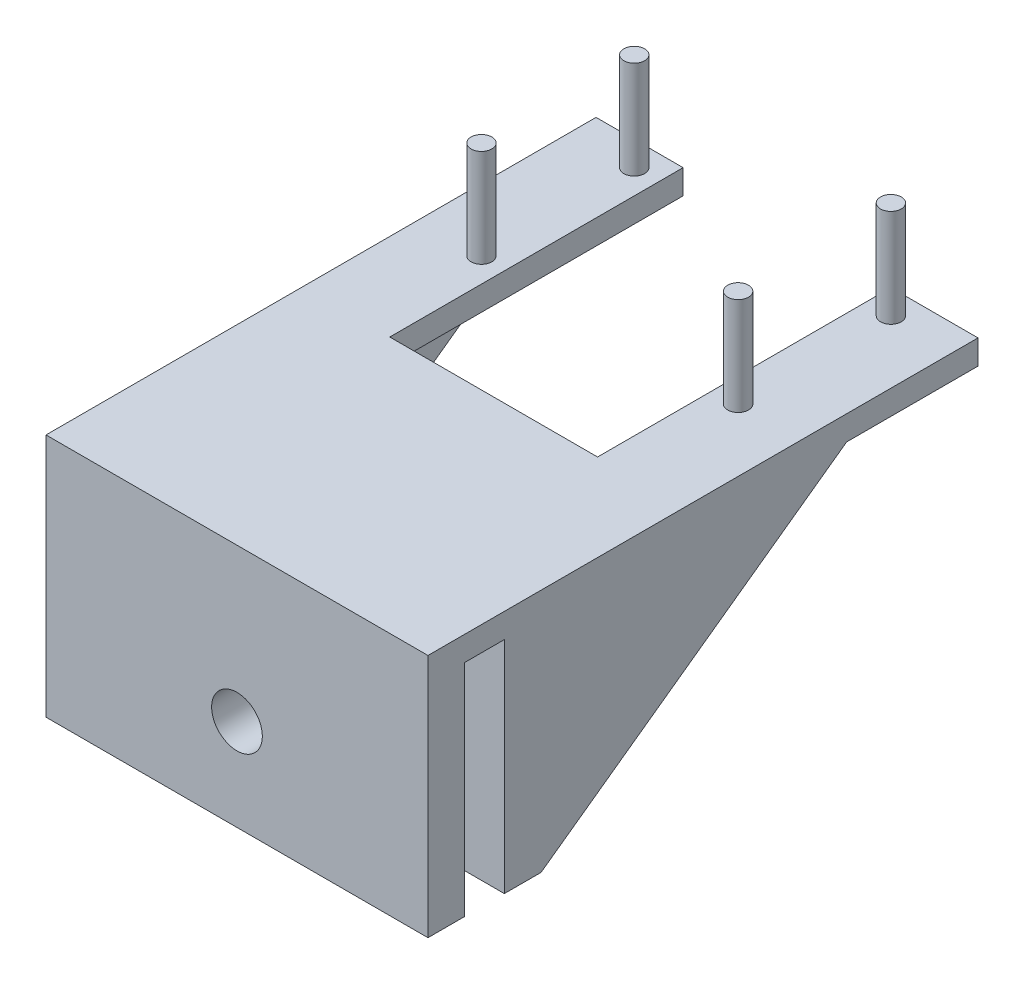
from build123d import *

# Parameters (mm, degrees)
BOSS_EXTRUDE1_DEPTH = 2
SKETCH3_R           = 0.85
BOSS_EXTRUDE2_DEPTH = 8
SKETCH4_W           = 31.25
SKETCH4_H           = 3
BOSS_EXTRUDE3_DEPTH = 18
SKETCH12_R          = 2.075
CUT_EXTRUDE2_DEPTH  = 58.667690261
RIB1_REACH          = 59.668
SKETCH13_WALL_W     = 148.141224122
SKETCH13_WALL_H     = 4
RIB2_REACH          = 59.668
SKETCH14_WALL_W     = 148.141224122
SKETCH14_WALL_H     = 4


with BuildPart() as part:
    # Sketch2 → Boss-Extrude1 (new body)
    with BuildSketch(Plane(origin=(0, 0, 0), x_dir=(1, 0, 0), z_dir=(0, 1, 0))):
        Polygon((0, 0), (0, 45), (7.125, 45), (7.125, 21), (24.125, 21), (24.125, 45), (31.25, 45), (31.25, 0), align=None)
    extrude(amount=BOSS_EXTRUDE1_DEPTH)

    # Sketch3 → Boss-Extrude2 (add)
    with BuildSketch(Plane(origin=(0, 2, 0), x_dir=(1, 0, 0), z_dir=(0, 1, 0))):
        with Locations(Location((5.125, 43, 0), (0, 0, 90))):
            Circle(SKETCH3_R)
        with Locations(Location((5.125, 30.5, 0), (0, 0, 90))):
            Circle(SKETCH3_R)
        with Locations(Location((26.125, 30.5, 0), (0, 0, 90))):
            Circle(SKETCH3_R)
        with Locations(Location((26.125, 43, 0), (0, 0, 90))):
            Circle(SKETCH3_R)
    extrude(amount=BOSS_EXTRUDE2_DEPTH)

    # Sketch4 → Boss-Extrude3 (add)
    with BuildSketch(Plane.XZ):
        with Locations((15.625, -1.5)):
            Rectangle(SKETCH4_W, SKETCH4_H)
        with Locations((15.625, -7.75)):
            Rectangle(SKETCH4_W, SKETCH4_H)
    extrude(amount=BOSS_EXTRUDE3_DEPTH)

    # Sketch12 → Cut-Extrude2 (cut, through all)
    with BuildSketch(Plane.XY):
        with Locations((15.625, -10.5)):
            Circle(SKETCH12_R)
    extrude(amount=-CUT_EXTRUDE2_DEPTH, mode=Mode.SUBTRACT)

    # Sketch13 wall → Rib1 (add, up to next)
    with BuildSketch(Plane(origin=(0, -9, -21.75), x_dir=(0, -0.584304725845, 0.811534341451), z_dir=(0, -0.811534341451, -0.584304725845)), mode=Mode.PRIVATE) as rib1_sk1:
        with Locations((0, -2)):
            Rectangle(SKETCH13_WALL_W, SKETCH13_WALL_H)
    rib1_tool1 = extrude(rib1_sk1.sketch, amount=-RIB1_REACH, mode=Mode.PRIVATE) - part.part
    add(rib1_tool1.solids().sort_by_distance((0, -9, -21.75))[0])

    # Sketch14 wall → Rib2 (add, up to next)
    with BuildSketch(Plane(origin=(31.25, -9, -21.75), x_dir=(0, -0.584304725845, 0.811534341451), z_dir=(0, -0.811534341451, -0.584304725845)), mode=Mode.PRIVATE) as rib2_sk1:
        with Locations((0, 2)):
            Rectangle(SKETCH14_WALL_W, SKETCH14_WALL_H)
    rib2_tool1 = extrude(rib2_sk1.sketch, amount=-RIB2_REACH, mode=Mode.PRIVATE) - part.part
    add(rib2_tool1.solids().sort_by_distance((31.25, -9, -21.75))[0])


solid = part.part
